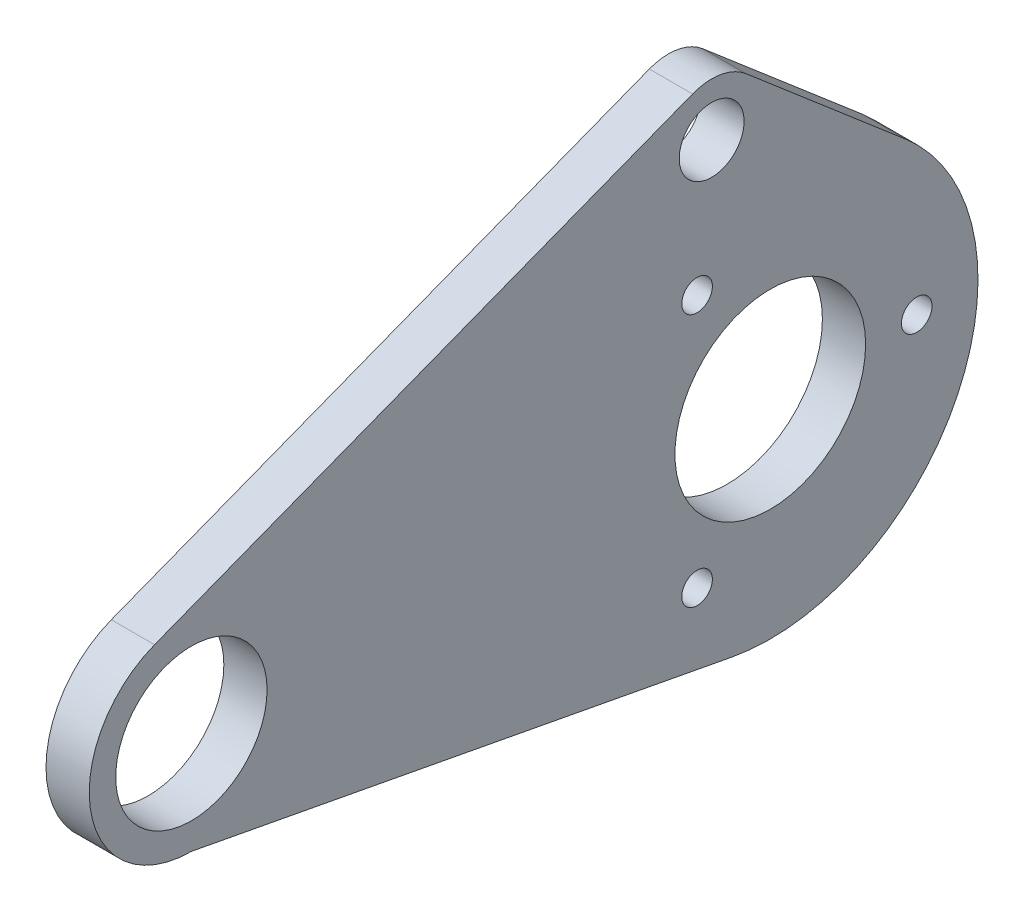
from build123d import *

# Parameters (mm, degrees)
SKETCH1_R            = 11.1125
SKETCH1_R_2          = 14
SKETCH1_R_3          = 4.7625
BOSS_EXTRUDE1_DEPTH  = 3.175
M4_CLEARANCE_HOLE1_D = 4.5


with BuildPart() as part:
    # Sketch1 → Boss-Extrude1 (new, symmetric)
    with BuildSketch(Plane(origin=(0, 0, 0), x_dir=(0, 0, -1), z_dir=(1, 0, 0))):
        with BuildLine():
            ThreePointArc((81.432924752, 43.180446665), (77.696268156, 44.932233649), (73.589867092, 44.521343816))
            Line((73.589867092, 44.521343816), (-5.407259882, 13.991481))
            ThreePointArc((-5.407259882, 13.991481), (-14.745714886, -2.750253171), (0, -15))
            Line((0, -15), (79.344909163, -29.971151924))
            ThreePointArc((79.344909163, -29.971151924), (112.50372992, -13.183127113), (104.821761092, 23.180763301))
            Line((104.821761092, 23.180763301), (81.432924752, 43.180446665))
        make_face()
        Circle(SKETCH1_R, mode=Mode.SUBTRACT)
        with Locations((85, 0)):
            Circle(SKETCH1_R_2, mode=Mode.SUBTRACT)
        with Locations((76.388124081, 37.280752399)):
            Circle(SKETCH1_R_3, mode=Mode.SUBTRACT)
    extrude(amount=BOSS_EXTRUDE1_DEPTH, both=True)

    # M4 Clearance Hole1 (through all)
    with Locations(Plane(origin=(3.175, 0, 0), x_dir=(0, 0, -1), z_dir=(1, 0, 0))):
        with Locations((74.25, 18.619546181), (106.5, 0), (74.25, -18.619546181)):
            Hole(M4_CLEARANCE_HOLE1_D / 2)


solid = part.part
